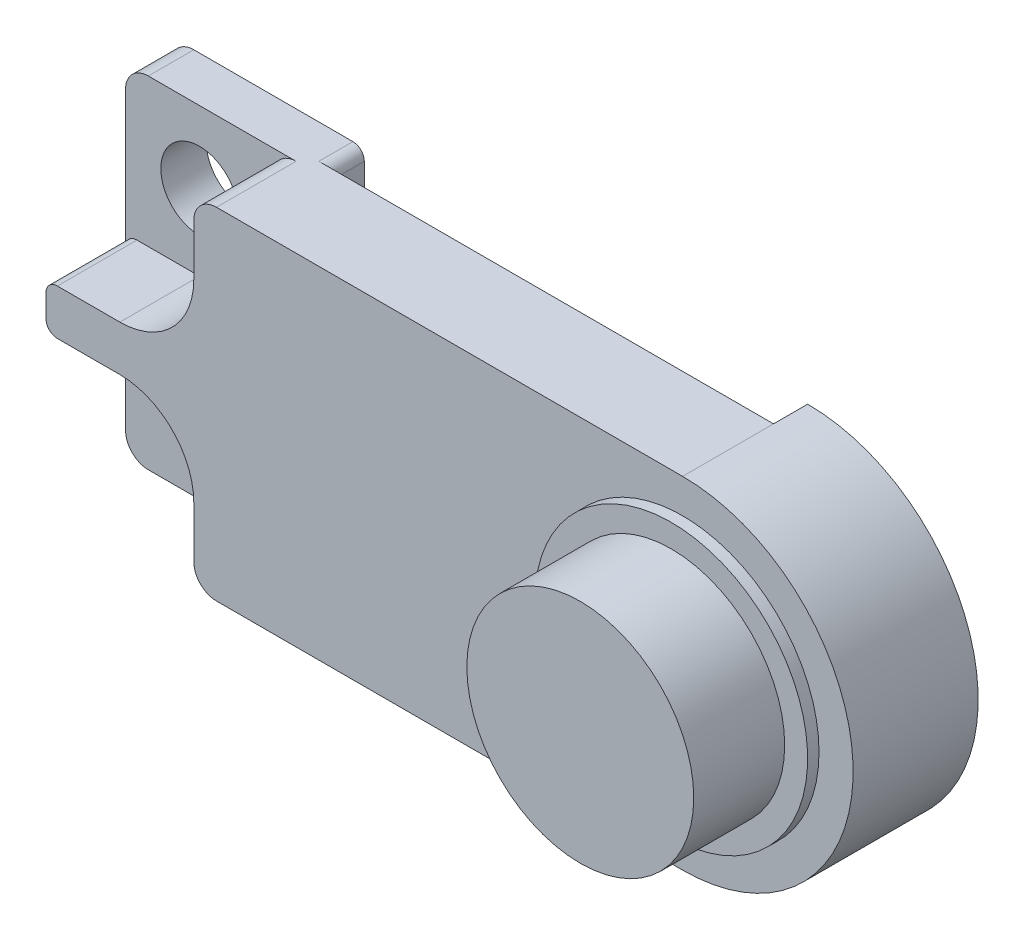
from build123d import *

# Parameters (mm, degrees)
EXTRUDE_1_DEPTH         = 5.5
SKETCH_2_W              = 19.5
SKETCH_2_H              = 1.5
CUT_EXTRUDE_1_DEPTH     = 32.372758884
SKETCH_3_W              = 6.5
SKETCH_3_H              = 3.5
CUT_EXTRUDE_2_DEPTH     = 6.5
SKETCH_4_W              = 3.5
SKETCH_4_H              = 6.5
CUT_EXTRUDE_3_DEPTH     = 6.5
HOLE_WIZARD_3_4_3_4_1_D = 3.4
FILLET_1_R              = 0.5
FILLET_2_R              = 1
FILLET_3_R              = 3.25


with BuildPart() as part:
    # 草图1 → 凸台-拉伸1 (new body)
    with BuildSketch(Plane.XY.offset(5.5)):
        with BuildLine():
            Line((19.5, 5.666127278), (-8.5, 5.666127278))
            Line((-8.5, 5.666127278), (-8.5, -9.333872722))
            Line((-8.5, -9.333872722), (19.5, -9.333872722))
            ThreePointArc((19.5, -9.333872722), (27, -1.833872722), (19.5, 5.666127278))
        make_face()
    extrude(amount=-EXTRUDE_1_DEPTH)

    # 草图2 → 切除-拉伸1 (cut, through all)
    with BuildSketch(Plane.XZ.offset(9.333872722)):
        with Locations((9.75, 0.75)):
            Rectangle(SKETCH_2_W, SKETCH_2_H)
    extrude(amount=-CUT_EXTRUDE_1_DEPTH, mode=Mode.SUBTRACT)

    # 草图3 → 切除-拉伸2 (cut)
    with BuildSketch(Plane(origin=(0, 5.666127278, 0), x_dir=(-1, 0, 0), z_dir=(0, 1, 0))):
        with Locations((5.25, 3.75)):
            Rectangle(SKETCH_3_W, SKETCH_3_H)
    extrude(amount=-CUT_EXTRUDE_2_DEPTH, mode=Mode.SUBTRACT)

    # 草图4 → 切除-拉伸3 (cut)
    with BuildSketch(Plane.ZY.offset(8.5)):
        with Locations((3.75, -6.083872722)):
            Rectangle(SKETCH_4_W, SKETCH_4_H)
    extrude(amount=-CUT_EXTRUDE_3_DEPTH, mode=Mode.SUBTRACT)

    # 草图5 → 旋转1 (revolve)
    with BuildSketch(Plane.XZ.offset(1.833872722), mode=Mode.PRIVATE) as revolve_1_sk:
        Polygon((24.49, 10), (19.5, 10), (19.5, 5.5), (25.5, 5.5), (25.5, 6), (24.49, 6), align=None)
    revolve(revolve_1_sk.sketch.rotate(Axis((19.5, -1.833872722, 10), (0, 0, -1)), 180), axis=Axis((19.5, -1.833872722, 10), (0, 0, -1)))

    # Ø3.4 (3.4) 直径孔1 (through all)
    with Locations(Plane.XY.offset(2)):
        with Locations((-5.25, 2.416127278), (-5.25, -6.083872722)):
            Hole(HOLE_WIZARD_3_4_3_4_1_D / 2)

    # 圆角1
    fillet_1_edges = [part.edges().sort_by_distance(p)[0] for p in [
        (0, 5.666127278, 0.75),
        (0, -9.333872722, 0.75),
        (-8.5, -0.833872722, 3.75),
        (-8.5, -2.833872722, 3.75),
    ]]
    fillet(fillet_1_edges, radius=FILLET_1_R)

    # 圆角2
    fillet_2_edges = [part.edges().sort_by_distance(p)[0] for p in [
        (-2, 5.666127278, 3.75),
        (-2, -9.333872722, 3.75),
        (-8.5, -9.333872722, 1),
        (-8.5, 5.666127278, 1),
    ]]
    fillet(fillet_2_edges, radius=FILLET_2_R)

    # 圆角3
    fillet_3_edges = [part.edges().sort_by_distance(p)[0] for p in [
        (-2, -0.833872722, 3.75),
        (-2, -2.833872722, 3.75),
    ]]
    fillet(fillet_3_edges, radius=FILLET_3_R)


solid = part.part
